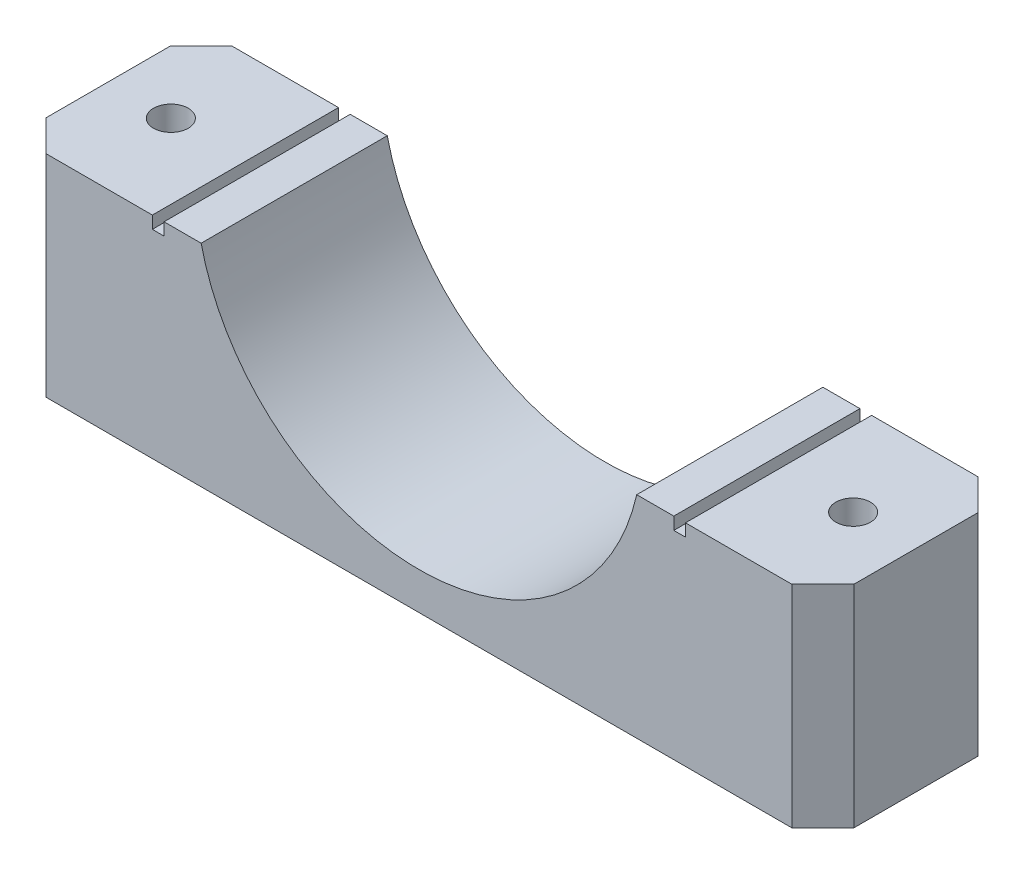
from build123d import *

# Parameters (mm, degrees)
BOSS_EXTRUDE1_DEPTH = 15
CHAMFER1_SIZE       = 2.5
SKETCH2_R           = 1.4
CUT_EXTRUDE1_DEPTH  = 40.667340007
SKETCH3_W           = 0.942684348
SKETCH3_H           = 15
CUT_EXTRUDE2_DEPTH  = 1


with BuildPart() as part:
    # Sketch1 → Boss-Extrude1 (new body)
    with BuildSketch(Plane.XY):
        with BuildLine():
            Line((-17.549928775, -4), (-32.549928775, -4))
            Line((-32.549928775, -4), (-32.549928775, -21))
            Line((-32.549928775, -21), (32.549928775, -21))
            Line((32.549928775, -21), (32.549928775, -4))
            Line((32.549928775, -4), (17.549928775, -4))
            ThreePointArc((17.549928775, -4), (0, -18), (-17.549928775, -4))
        make_face()
    extrude(amount=BOSS_EXTRUDE1_DEPTH)

    # Chamfer1
    chamfer1_edges = [part.edges().sort_by_distance(p)[0] for p in [
        (-32.549928775, -12.5, 15),
        (32.549928775, -12.5, 15),
        (-32.549928775, -12.5, 0),
        (32.549928775, -12.5, 0),
    ]]
    chamfer(chamfer1_edges, length=CHAMFER1_SIZE)

    # Sketch2 → Cut-Extrude1 (cut, through all)
    with BuildSketch(Plane(origin=(0, -4, 0), x_dir=(1, 0, 0), z_dir=(0, 1, 0))):
        with Locations(Location((27.488644481, -7.5, 0), (0, 0, 180))):
            Circle(SKETCH2_R)
        with Locations((-27.488644481, -7.5)):
            Circle(SKETCH2_R)
    extrude(amount=-CUT_EXTRUDE1_DEPTH, mode=Mode.SUBTRACT)

    # Sketch3 → Cut-Extrude2 (cut)
    with BuildSketch(Plane(origin=(0, -4, 0), x_dir=(1, 0, 0), z_dir=(0, 1, 0))):
        with Locations((-21.008394031, -7.5)):
            Rectangle(SKETCH3_W, SKETCH3_H)
    cut_extrude2 = extrude(amount=-CUT_EXTRUDE2_DEPTH, mode=Mode.SUBTRACT)

    # Mirror1: Cut-Extrude2 across plane
    add(cut_extrude2.mirror(Plane(origin=(0, 0, 0), x_dir=(0, 0, 1), z_dir=(1, 0, 0))), mode=Mode.SUBTRACT)


solid = part.part
